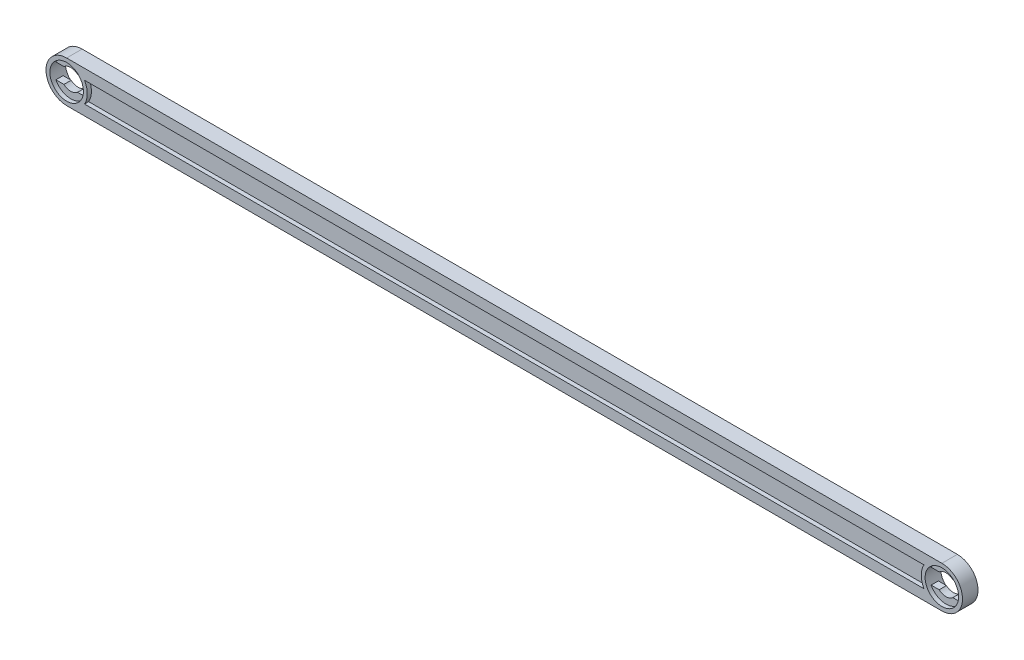
from build123d import *

# Parameters (mm, degrees)
EXTRUDE_1_DEPTH        = 3
CUT_EXTRUDE_1_REACH    = 175.672
SKETCH_3_R             = 3.25
CUT_EXTRUDE_2_DEPTH    = 0.8
CUT_EXTRUDE_START      = -2.2
SKETCH_3_2_R           = 3.25
CUT_EXTRUDE_3_DEPTH    = 0.8
PATTERN_LINEAR_1_COUNT = 2
PATTERN_LINEAR_1_PITCH = 169.6
CUT_EXTRUDE_4_DEPTH    = 0.8
SKETCH_5_W             = 161.6
SKETCH_5_H             = 4
CUT_EXTRUDE_5_DEPTH    = 0.8


with BuildPart() as part:
    # 草图1 → 凸台-拉伸1 (new body)
    with BuildSketch(Plane.XY):
        with BuildLine():
            Line((0, 4), (169.6, 4))
            ThreePointArc((169.6, 4), (173.6, 0), (169.6, -4))
            Line((169.6, -4), (0, -4))
            ThreePointArc((0, -4), (-4, 0), (0, 4))
        make_face()
    extrude(amount=-EXTRUDE_1_DEPTH)

    # 草图2 → 切除-拉伸1 (cut, up to next)
    with BuildSketch(Plane.XY, mode=Mode.PRIVATE) as cut_extrude_1_sk1:
        with BuildLine():
            Line((1.322875656, -1.5), (2.883140649, -1.5))
            ThreePointArc((2.883140649, -1.5), (3.25, 0), (2.883140649, 1.5))
            Line((2.883140649, 1.5), (1.322875656, 1.5))
            ThreePointArc((1.322875656, 1.5), (0, 2), (-1.322875656, 1.5))
            Line((-1.322875656, 1.5), (-2.883140649, 1.5))
            ThreePointArc((-2.883140649, 1.5), (-3.25, 0), (-2.883140649, -1.5))
            Line((-2.883140649, -1.5), (-1.322875656, -1.5))
            ThreePointArc((-1.322875656, -1.5), (0, -2), (1.322875656, -1.5))
        make_face()
    cut_extrude_1_tool1 = extrude(cut_extrude_1_sk1.sketch, amount=-CUT_EXTRUDE_1_REACH, mode=Mode.PRIVATE) & part.part
    cut_extrude_1 = cut_extrude_1_tool1.solids().sort_by_distance((0, 0, 0))[0]
    add(cut_extrude_1, mode=Mode.SUBTRACT)

    # 草图3 → 切除-拉伸2 (cut)
    with BuildSketch(Plane.XY):
        Circle(SKETCH_3_R)
    cut_extrude_2 = extrude(amount=-CUT_EXTRUDE_2_DEPTH, mode=Mode.SUBTRACT)

    # 草图3<2> → 切除-拉伸3 (cut)
    with BuildSketch(Plane.XY.offset(CUT_EXTRUDE_START)):
        Circle(SKETCH_3_2_R)
    cut_extrude_3 = extrude(amount=-CUT_EXTRUDE_3_DEPTH, mode=Mode.SUBTRACT)

    # 阵列(线性)1: 切除-拉伸1, 切除-拉伸2, 切除-拉伸3 ×2
    with Locations(*[(i * PATTERN_LINEAR_1_PITCH, 0, 0) for i in range(1, PATTERN_LINEAR_1_COUNT)]):
        add(cut_extrude_1, mode=Mode.SUBTRACT)
        add(cut_extrude_2, mode=Mode.SUBTRACT)
        add(cut_extrude_3, mode=Mode.SUBTRACT)

    # 草图4 → 切除-拉伸4 (cut)
    with BuildSketch(Plane.XY):
        with BuildLine():
            Line((3.464101615, 2), (166.135898385, 2))
            ThreePointArc((166.135898385, 2), (165.6, 0), (166.135898385, -2))
            Line((166.135898385, -2), (3.464101615, -2))
            ThreePointArc((3.464101615, -2), (4, 0), (3.464101615, 2))
        make_face()
    extrude(amount=-CUT_EXTRUDE_4_DEPTH, mode=Mode.SUBTRACT)

    # 草图5 → 切除-拉伸5 (cut)
    with BuildSketch(Plane(origin=(0, 0, -3), x_dir=(-1, 0, 0), z_dir=(0, 0, -1))):
        with Locations((-84.8, 0)):
            Rectangle(SKETCH_5_W, SKETCH_5_H)
    extrude(amount=-CUT_EXTRUDE_5_DEPTH, mode=Mode.SUBTRACT)


solid = part.part
